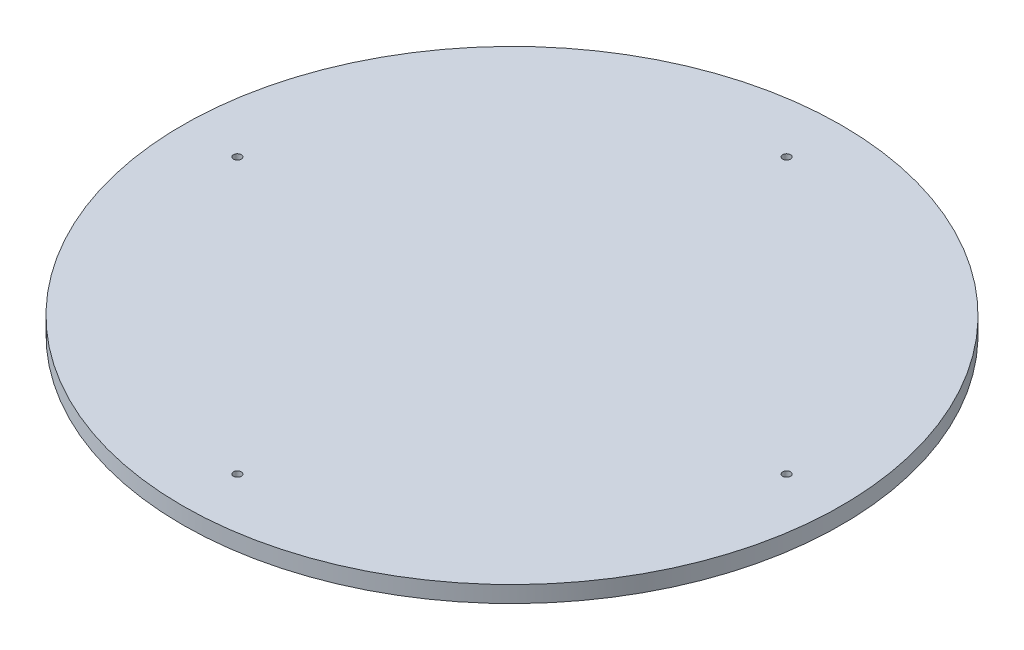
from build123d import *

# Parameters (mm, degrees)
SKETCH1_R                                        = 300
BOSS_EXTRUDE1_DEPTH                              = 15
CBORE_FOR_1_4_SOCKET_HEAD_CAP_SCREW1_D           = 7.14248
CBORE_FOR_1_4_SOCKET_HEAD_CAP_SCREW1_CBORE_D     = 11.1125
CBORE_FOR_1_4_SOCKET_HEAD_CAP_SCREW1_CBORE_DEPTH = 6.35


with BuildPart() as part:
    # Sketch1 → Boss-Extrude1 (new body)
    with BuildSketch(Plane(origin=(0, 0, 0), x_dir=(1, 0, 0), z_dir=(0, 1, 0))):
        with Locations(Location((0, 0, 0), (0, 0, 270))):
            Circle(SKETCH1_R)
    extrude(amount=BOSS_EXTRUDE1_DEPTH)

    # CBORE for 1/4 Socket Head Cap Screw1 (through all)
    with Locations(Plane.XZ):
        with Locations((-250, 0), (0, -250), (250, 0), (0, 250)):
            CounterBoreHole(CBORE_FOR_1_4_SOCKET_HEAD_CAP_SCREW1_D / 2, CBORE_FOR_1_4_SOCKET_HEAD_CAP_SCREW1_CBORE_D / 2, CBORE_FOR_1_4_SOCKET_HEAD_CAP_SCREW1_CBORE_DEPTH)


solid = part.part
